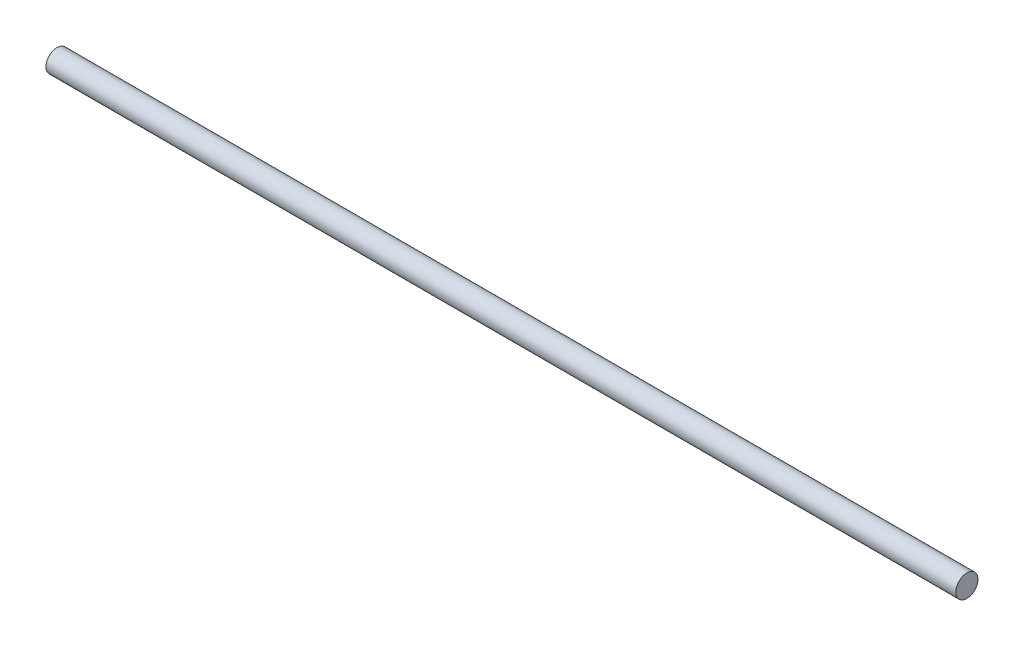
from build123d import *

# Parameters (mm, degrees)
SKETCH_1_R      = 3
EXTRUDE_1_DEPTH = 246


with BuildPart() as part:
    # 草图1 → 凸台-拉伸1 (new body)
    with BuildSketch(Plane(origin=(0, 0, 0), x_dir=(0, 0, -1), z_dir=(1, 0, 0))):
        Circle(SKETCH_1_R)
    extrude(amount=EXTRUDE_1_DEPTH)


solid = part.part
